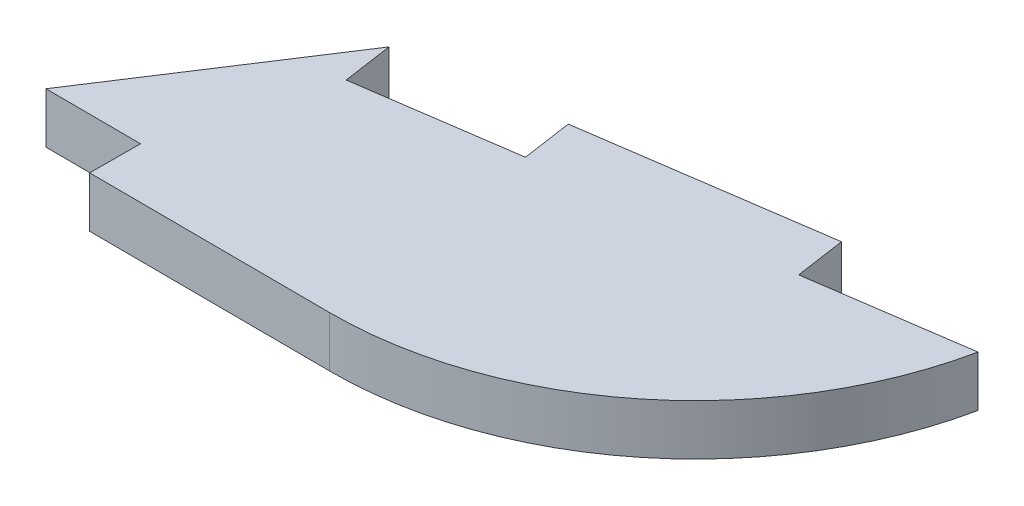
from build123d import *

# Parameters (mm, degrees)
P_IDAT_VYSUNUT_M1_DEPTH = 0.8


with BuildPart() as part:
    # Skica1 → Přidat vysunutím1 (new, symmetric)
    with BuildSketch(Plane(origin=(0, 0, 0), x_dir=(1, 0, 0), z_dir=(0, 1, 0))):
        with BuildLine():
            Line((21.590966819, 1.114633571), (21.584116759, -0.485351766))
            Line((21.584116759, -0.485351766), (29.204046923, -0.517975177))
            ThreePointArc((29.204046923, -0.517975177), (36.502348534, 2.047731055), (40.53322014, 8.650770428))
            Line((40.53322014, 8.650770428), (35.585436473, 7.930050796))
            Line((35.585436473, 7.930050796), (35.354806191, 9.513341569))
            Line((35.354806191, 9.513341569), (27.814383883, 8.41496485))
            Line((27.814383883, 8.41496485), (28.045014165, 6.831674076))
            Line((28.045014165, 6.831674076), (23.097230499, 6.110954444))
            Line((23.097230499, 6.110954444), (22.866600217, 7.694245217))
            Line((22.866600217, 7.694245217), (18.590994313, 1.127477433))
            Line((18.590994313, 1.127477433), (21.590966819, 1.114633571))
        make_face()
    extrude(amount=P_IDAT_VYSUNUT_M1_DEPTH, both=True)


solid = part.part
